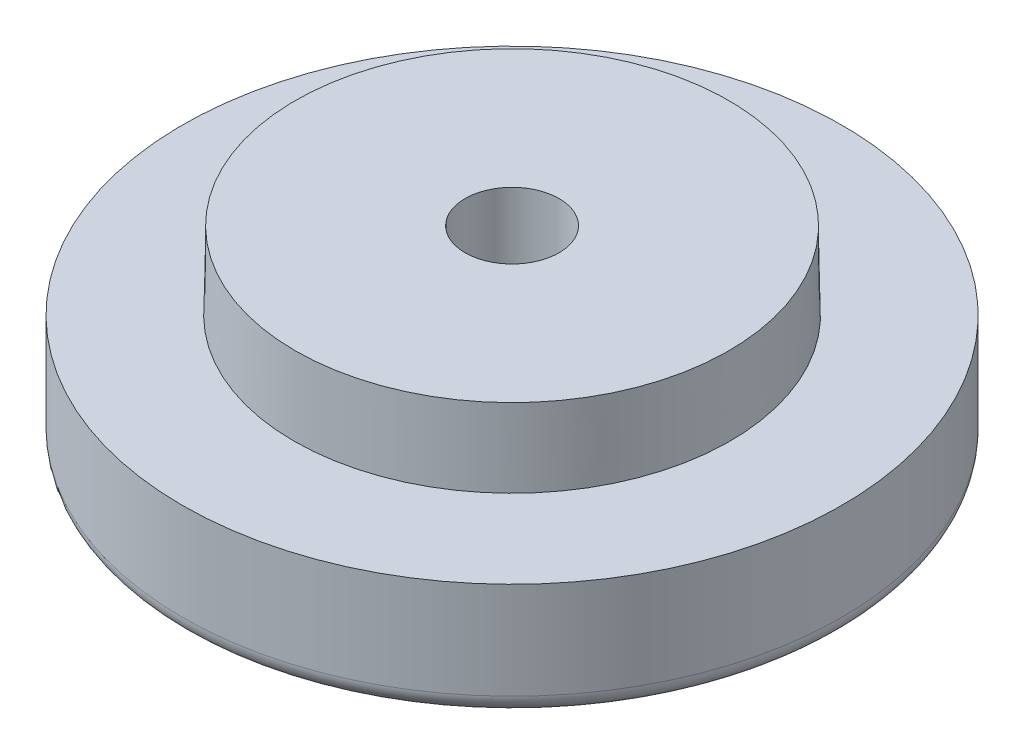
from build123d import *

# Parameters (mm, degrees)
SKETCH2_R           = 34
BOSS_EXTRUDE1_DEPTH = 12
SKETCH3_R           = 22.5
BOSS_EXTRUDE3_DEPTH = 8
BOSS_EXTRUDE3_TAPER = 1
SKETCH4_R           = 4.85
CUT_EXTRUDE1_DEPTH  = 53.076866265
FILLET1_R           = 2


with BuildPart() as part:
    # Sketch2 → Boss-Extrude1 (new body)
    with BuildSketch(Plane(origin=(0, 0, 0), x_dir=(1, 0, 0), z_dir=(0, 1, 0))):
        with Locations(Location((0, 0, 0), (0, 0, 270))):
            Circle(SKETCH2_R)
    extrude(amount=BOSS_EXTRUDE1_DEPTH)


with BuildPart() as body_2:
    # Sketch3 → Boss-Extrude3 (new body)
    with BuildSketch(Plane(origin=(0, 12, 0), x_dir=(1, 0, 0), z_dir=(0, 1, 0))):
        Circle(SKETCH3_R)
    extrude(amount=BOSS_EXTRUDE3_DEPTH, taper=BOSS_EXTRUDE3_TAPER)


with BuildPart() as cut_extrude1_tool:
    # Sketch4 → Cut-Extrude1 (new, through all)
    with BuildSketch(Plane(origin=(0, 20, 0), x_dir=(1, 0, 0), z_dir=(0, 1, 0))):
        with Locations(Location((0, 0, 0), (0, 0, 270))):
            Circle(SKETCH4_R)
    extrude(amount=-CUT_EXTRUDE1_DEPTH)


with BuildPart() as part_1:
    add(part.part)

    # Cut-Extrude1: cut by cut_extrude1_tool
    add(cut_extrude1_tool.part, mode=Mode.SUBTRACT)

    # Fillet1
    fillet1_edges = [part_1.edges().sort_by_distance(p)[0] for p in [
        (0, 0, -34),
    ]]
    fillet(fillet1_edges, radius=FILLET1_R)


with BuildPart() as body_2_1:
    add(body_2.part)

    # Cut-Extrude1: cut by cut_extrude1_tool
    add(cut_extrude1_tool.part, mode=Mode.SUBTRACT)


solid = Compound([part_1.part, body_2_1.part])
